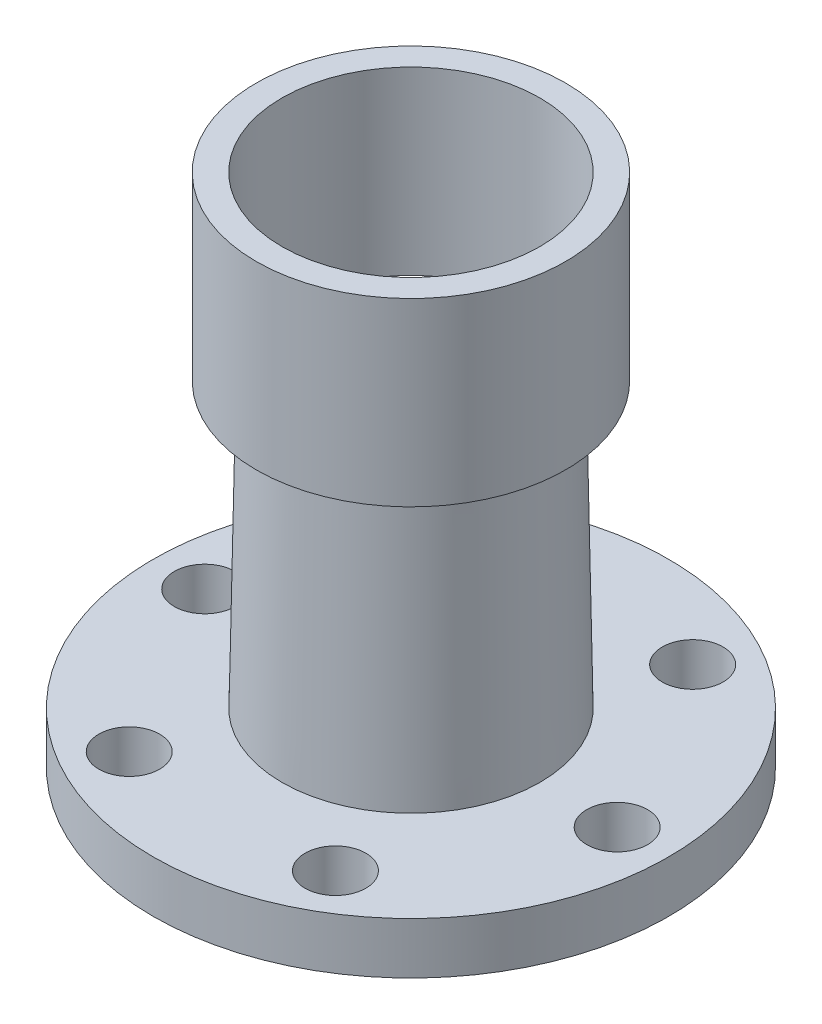
from build123d import *

# Parameters (mm, degrees)
SKETCH1_R           = 50
BOSS_EXTRUDE1_DEPTH = 5
SKETCH2_R           = 25
SKETCH2_R_2         = 20
BOSS_EXTRUDE2_DEPTH = 55
BOSS_EXTRUDE2_DRAFT = 1
SKETCH3_R           = 30
SKETCH3_R_2         = 25
BOSS_EXTRUDE3_DEPTH = 35
SKETCH5_W           = 5.9
SKETCH5_H           = 10
CIRPATTERN1_COUNT   = 6


with BuildPart() as part:
    # Sketch1 → Boss-Extrude1 (new, symmetric)
    with BuildSketch(Plane(origin=(0, 0, 0), x_dir=(1, 0, 0), z_dir=(0, 1, 0))):
        with Locations(Location((0, 0, 0), (0, 0, 270))):
            Circle(SKETCH1_R)
    extrude(amount=BOSS_EXTRUDE1_DEPTH, both=True)


with BuildPart() as boss_extrude2_tool:
    # Sketch2 → Boss-Extrude2 (with draft: the straight prism first)
    with BuildSketch(Plane(origin=(0, 5, 0), x_dir=(1, 0, 0), z_dir=(0, 1, 0))):
        Circle(SKETCH2_R)
        Circle(SKETCH2_R_2, mode=Mode.SUBTRACT)
    extrude(amount=BOSS_EXTRUDE2_DEPTH)
    # Boss-Extrude2: the draft: its side faces are tilted about the plane it starts from
    boss_extrude2_sides = [boss_extrude2_tool.faces().sort_by_distance(p)[0] for p in [
        (-25, 32.5, 0),
        (-20, 32.5, 0),
    ]]
    draft(boss_extrude2_sides, Plane(origin=(0, 5, 0), x_dir=(1, 0, 0), z_dir=(0, 1, 0)), BOSS_EXTRUDE2_DRAFT)


with BuildPart() as part_1:
    add(part.part)

    # Boss-Extrude2: add boss_extrude2_tool
    add(boss_extrude2_tool.part)

    # Sketch5 → Hole1 (revolve, cut)
    with BuildSketch(Plane(origin=(40, 5, 0), x_dir=(0, 0, 1), z_dir=(1, 0, 0))):
        with Locations((2.95, 5)):
            Rectangle(SKETCH5_W, SKETCH5_H)
    hole1 = revolve(axis=Axis((40, -105, 0), (0, 1, 0)), mode=Mode.SUBTRACT)

    # CirPattern1: Hole1 ×6 about axis
    cirpattern1_axis = Axis((0, 0, 0), (0, 1, 0))
    for i in range(1, CIRPATTERN1_COUNT):
        add(hole1.rotate(cirpattern1_axis, i * 360 / CIRPATTERN1_COUNT), mode=Mode.SUBTRACT)


with BuildPart() as body_2:
    # Sketch3 → Boss-Extrude3 (new body)
    with BuildSketch(Plane(origin=(0, 60, 0), x_dir=(1, 0, 0), z_dir=(0, 1, 0))):
        with Locations(Location((0, 0, 0), (0, 0, 270))):
            Circle(SKETCH3_R)
        with Locations(Location((0, 0, 0), (0, 0, 270))):
            Circle(SKETCH3_R_2, mode=Mode.SUBTRACT)
    extrude(amount=BOSS_EXTRUDE3_DEPTH)


solid = Compound([part_1.part, body_2.part])
